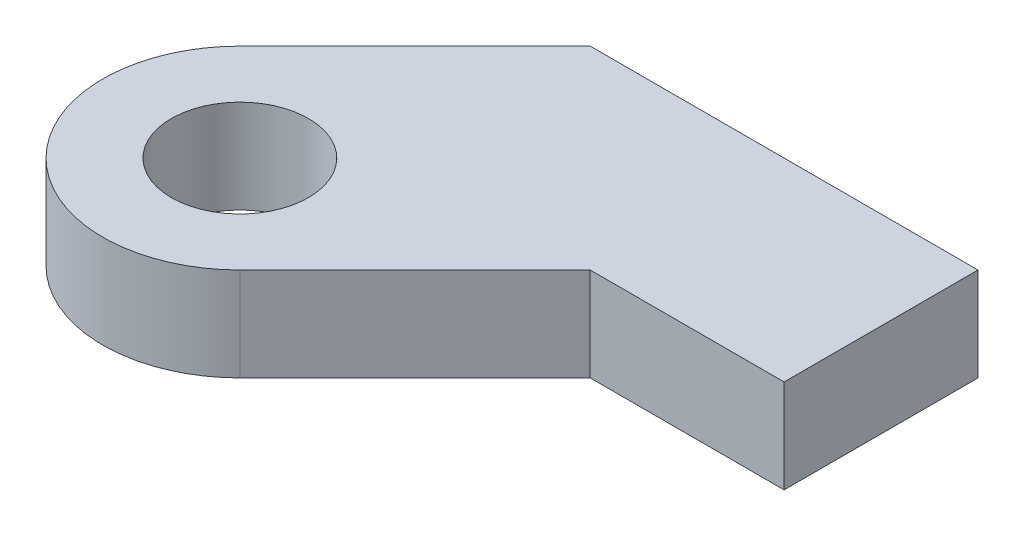
from build123d import *

# Parameters (mm, degrees)
SKETCH_2_R      = 1.1
EXTRUDE_1_DEPTH = 1.5


with BuildPart() as part:
    # 草图2 → 凸台-拉伸1 (new body)
    with BuildSketch(Plane(origin=(0, 0, 0), x_dir=(1, 0, 0), z_dir=(0, 1, 0))):
        with BuildLine():
            Line((1.537957249, 1.537957249), (4.649227086, 1.537957249))
            Line((4.649227086, 1.537957249), (4.649227086, -1.573312588))
            Line((4.649227086, -1.573312588), (1.537957249, -1.573312588))
            Line((1.537957249, -1.573312588), (-1.272792206, -4.384062043))
            ThreePointArc((-1.272792206, -4.384062043), (-4.384062043, -4.384062043), (-4.384062043, -1.272792206))
            Line((-4.384062043, -1.272792206), (-1.573312588, 1.537957249))
            Line((-1.573312588, 1.537957249), (1.537957249, 1.537957249))
        make_face()
        with Locations(Location((-2.828427125, -2.828427125, 0), (0, 0, 270))):
            Circle(SKETCH_2_R, mode=Mode.SUBTRACT)
    extrude(amount=EXTRUDE_1_DEPTH)


solid = part.part
